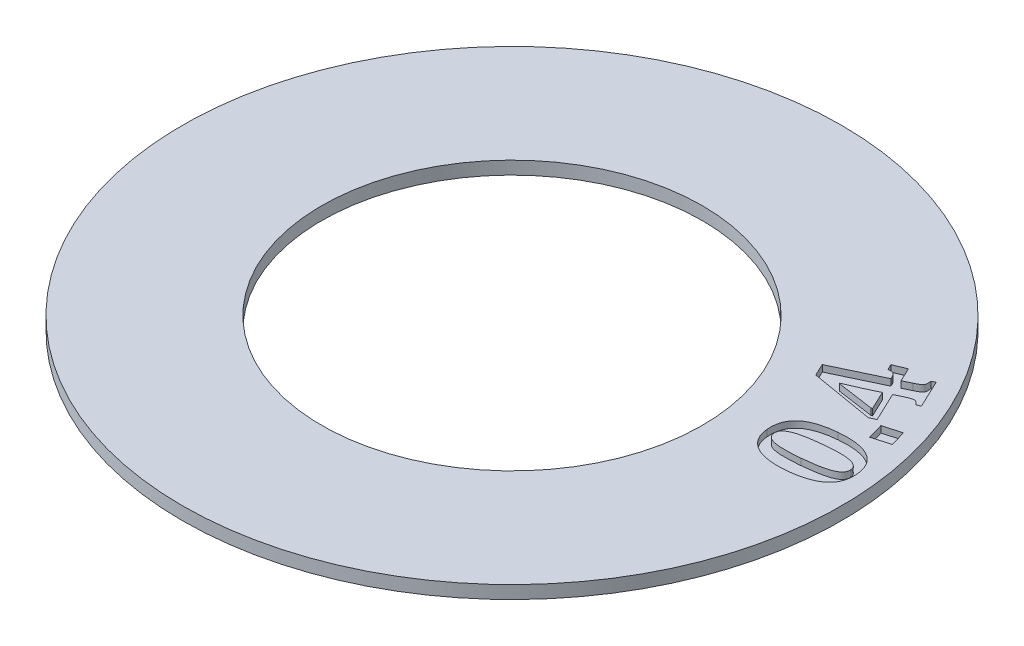
from build123d import *

# Parameters (mm, degrees)
SKETCH1_R           = 10.16
BOSS_EXTRUDE1_DEPTH = 0.4
SKETCH2_R           = 5.8674
CUT_EXTRUDE1_DEPTH  = 15.373976485
CUT_EXTRUDE2_DEPTH  = 0.2


with BuildPart() as part:
    # Sketch1 → Boss-Extrude1 (new body)
    with BuildSketch(Plane(origin=(0, 0, 0), x_dir=(1, 0, 0), z_dir=(0, 1, 0))):
        with Locations(Location((0, 0, 0), (0, 0, 270))):
            Circle(SKETCH1_R)
    extrude(amount=BOSS_EXTRUDE1_DEPTH)

    # Sketch2 → Cut-Extrude1 (cut, through all)
    with BuildSketch(Plane(origin=(0, 0, 0), x_dir=(-1, 0, 0), z_dir=(0, -1, 0))):
        with Locations(Location((0, 0, 0), (0, 0, 90))):
            Circle(SKETCH2_R)
    extrude(amount=-CUT_EXTRUDE1_DEPTH, mode=Mode.SUBTRACT)

    # Sketch4 → Cut-Extrude2 (cut)
    # profile 1 of 3: a face of its own
    with BuildSketch(Plane(origin=(0, 0.4, 0), x_dir=(1, 0, 0), z_dir=(0, 1, 0))):
        with BuildLine():
            add(Edge.make_bspline(
                [(9.548097961, 1.097469618), (9.550055121, 1.073968459), (9.553888422, 1.027939027), (9.554390186, 0.959782463), (9.550385332, 0.894277853), (9.543161692, 0.830950704), (9.529924907, 0.770564877), (9.514466283, 0.712015933), (9.493128413, 0.656576452), (9.46859878, 0.603112304), (9.438240587, 0.552630443), (9.403712845, 0.504076224), (9.363797313, 0.45815636), (9.318530635, 0.414953146), (9.268531255, 0.373440711), (9.212574881, 0.33528609), (9.152201079, 0.298537745), (9.086625336, 0.264527216), (9.015771284, 0.233035098), (8.939390022, 0.204332005), (8.85742296, 0.178713648), (8.770070519, 0.155516755), (8.677361705, 0.135213545), (8.579160422, 0.117686573), (8.475476658, 0.102717037), (8.40435551, 0.095299195), (8.367946051, 0.091501736)],
                knots=[0, 0, 0, 0, 0.959744186, 1.879757445, 2.771360733, 3.630433483, 4.470974874, 5.285729423, 6.092861057, 6.885868194, 7.677321799, 8.486806591, 9.30863703, 10.149710703, 11.031725224, 11.950856355, 12.90393232, 13.90755666, 14.955572763, 16.058595042, 17.227175211, 18.449982035, 19.736657795, 21.08935819, 22.509938377, 24, 24, 24, 24], degree=3))
            add(Edge.make_bspline(
                [(8.367946051, 0.091501736), (8.333424141, 0.088400085), (8.265746233, 0.082319503), (8.165677998, 0.079231171), (8.06952646, 0.077278789), (7.977053794, 0.081155481), (7.88830334, 0.087048161), (7.803306671, 0.098811355), (7.721736112, 0.11170348), (7.644437516, 0.130414375), (7.570830347, 0.151553041), (7.501385565, 0.177166916), (7.435509874, 0.205414386), (7.374430468, 0.238456025), (7.316418733, 0.273272083), (7.263625883, 0.313436527), (7.214343769, 0.356439358), (7.169055169, 0.402772658), (7.128001276, 0.452365342), (7.092229736, 0.505851447), (7.060066365, 0.561822042), (7.033139082, 0.62118597), (7.010403647, 0.683257406), (6.992100676, 0.748449734), (6.979079533, 0.816930644), (6.973464566, 0.863715974), (6.970615322, 0.887456597)],
                knots=[0, 0, 0, 0, 1.373964495, 2.693565985, 3.968553968, 5.185962309, 6.362128109, 7.493465967, 8.586945452, 9.634820339, 10.644545933, 11.621736809, 12.567827687, 13.483617295, 14.373243629, 15.247464012, 16.109610849, 16.964804151, 17.813643683, 18.658252232, 19.51307309, 20.370435758, 21.2393278, 22.1319618, 23.052087694, 24, 24, 24, 24], degree=3))
            add(Edge.make_bspline(
                [(6.970615322, 0.887456597), (6.968008966, 0.924187003), (6.962939891, 0.995623618), (6.968278191, 1.100187869), (6.982752186, 1.198611099), (7.008071475, 1.290725833), (7.04420274, 1.376531671), (7.090804819, 1.455803983), (7.147686668, 1.528817336), (7.215087504, 1.595277348), (7.293061596, 1.655917856), (7.382222508, 1.709460065), (7.481878053, 1.757653835), (7.592113819, 1.79993908), (7.713743669, 1.835405319), (7.845672722, 1.865615588), (7.988759307, 1.889211353), (8.087867057, 1.899976367), (8.139191711, 1.905551215)],
                knots=[0, 0, 0, 0, 0.999181933, 1.943299396, 2.836688392, 3.696188225, 4.530240668, 5.35776012, 6.186181664, 7.036493394, 7.921805995, 8.862264049, 9.85532249, 10.92466266, 12.06451709, 13.293082439, 14.598176172, 16, 16, 16, 16], degree=3))
            add(Edge.make_bspline(
                [(8.139191711, 1.905551215), (8.192076162, 1.909791843), (8.294429148, 1.917999186), (8.443873987, 1.920688736), (8.584142548, 1.915477705), (8.715338175, 1.902057842), (8.837357513, 1.88004073), (8.950319838, 1.850206381), (9.053768445, 1.810845774), (9.148284982, 1.764097891), (9.233267264, 1.708869395), (9.308278218, 1.645097177), (9.373256878, 1.573236551), (9.429154226, 1.493984326), (9.473668524, 1.40587554), (9.508962331, 1.310266213), (9.535431633, 1.206847242), (9.543804449, 1.134545408), (9.548097961, 1.097469618)],
                knots=[0, 0, 0, 0, 1.381791394, 2.674330027, 3.891007168, 5.036428095, 6.106690612, 7.117972597, 8.075364145, 8.985087285, 9.859944246, 10.708764313, 11.542333244, 12.37753583, 13.227367402, 14.105765436, 15.028652003, 16, 16, 16, 16], degree=3))
        make_face()
        with BuildLine():
            add(Edge.make_bspline(
                [(8.261561502, 0.646575521), (8.294456414, 0.649821856), (8.358447364, 0.656137), (8.451849855, 0.666375212), (8.539943244, 0.678399643), (8.622970291, 0.689310262), (8.700369127, 0.702561563), (8.772745842, 0.714744092), (8.839767332, 0.728682456), (8.901986015, 0.742841894), (8.959241455, 0.758465051), (9.012361258, 0.774117371), (9.061070952, 0.791611955), (9.106204362, 0.808792317), (9.147102593, 0.82752915), (9.183769707, 0.847406728), (9.216251369, 0.868414663), (9.253841893, 0.896112176), (9.292161978, 0.93470985), (9.324279971, 0.987899004), (9.341430959, 1.046837895), (9.339946559, 1.087265986), (9.33918737, 1.107942708)],
                knots=[0, 0, 0, 0, 1.559939649, 3.034573339, 4.433834629, 5.755759396, 6.985974602, 8.139252337, 9.219098498, 10.216076828, 11.149973839, 12.019543174, 12.828554085, 13.591800542, 14.297942877, 14.949827997, 15.558345547, 16.121961591, 17.152098737, 18.100852136, 19.028691373, 20, 20, 20, 20], degree=3))
            add(Edge.make_bspline(
                [(9.33918737, 1.107942708), (9.337640701, 1.119206946), (9.334605741, 1.141310259), (9.325241811, 1.172734036), (9.31176771, 1.201590004), (9.293873227, 1.227812058), (9.271323703, 1.251644445), (9.244711652, 1.274008937), (9.212873286, 1.293547355), (9.176637524, 1.311985124), (9.135144771, 1.328439431), (9.087936038, 1.342704924), (9.03486756, 1.354683111), (8.975778101, 1.364445967), (8.910136784, 1.372235916), (8.83765802, 1.377138278), (8.757841853, 1.378355959), (8.671282468, 1.377765829), (8.578631856, 1.375199821), (8.480728235, 1.369181036), (8.377787239, 1.362348998), (8.307484328, 1.355956026), (8.271483377, 1.352682292)],
                knots=[0, 0, 0, 0, 0.573306212, 1.12497326, 1.647738541, 2.175091007, 2.719775143, 3.2992746, 3.924540973, 4.60063781, 5.349821626, 6.17422386, 7.087672211, 8.09400518, 9.19609116, 10.423188986, 11.759030231, 13.224456304, 14.792560164, 16.436793354, 18.175341204, 20, 20, 20, 20], degree=3))
            add(Edge.make_bspline(
                [(8.271483377, 1.352682292), (8.21872765, 1.347383023), (8.117512767, 1.337216074), (7.972444719, 1.319230054), (7.840842152, 1.298928139), (7.722599788, 1.277041996), (7.617710788, 1.253595709), (7.525847566, 1.228398034), (7.447076026, 1.201897522), (7.380933906, 1.17356744), (7.325919961, 1.144098193), (7.28035653, 1.113538037), (7.243905652, 1.081205208), (7.215355923, 1.047943532), (7.195791651, 1.012267519), (7.182777989, 0.975237705), (7.176443594, 0.935977323), (7.177754028, 0.909335291), (7.178423481, 0.895724826)],
                knots=[0, 0, 0, 0, 1.987774042, 3.813658246, 5.479624312, 6.979295976, 8.321212524, 9.507797241, 10.549079436, 11.434594746, 12.202068828, 12.886080949, 13.486172645, 14.024182533, 14.520633445, 15.002090577, 15.490203663, 16, 16, 16, 16], degree=3))
            add(Edge.make_bspline(
                [(7.178423481, 0.895724826), (7.18057015, 0.880150586), (7.184763265, 0.849729237), (7.201322999, 0.807002831), (7.225450517, 0.768795664), (7.257660898, 0.735091078), (7.298058684, 0.706441494), (7.346173767, 0.682368855), (7.401776004, 0.661890172), (7.465624388, 0.646320653), (7.537344011, 0.634570729), (7.61681871, 0.625748345), (7.704218452, 0.620988642), (7.799654696, 0.620157169), (7.90331396, 0.622569433), (8.015409368, 0.627671035), (8.13581459, 0.635163946), (8.218766894, 0.642691896), (8.261561502, 0.646575521)],
                knots=[0, 0, 0, 0, 0.622531695, 1.215998619, 1.802972471, 2.4067536, 3.054715399, 3.759494987, 4.537400922, 5.402670149, 6.364594255, 7.421637757, 8.576224243, 9.838461732, 11.210360544, 12.692839009, 14.293854979, 16, 16, 16, 16], degree=3))
        make_face(mode=Mode.SUBTRACT)
    # profile 2 of 3: a face of its own
    with BuildSketch(Plane(origin=(0, 0.4, 0), x_dir=(1, 0, 0), z_dir=(0, 1, 0))):
        Polygon((8.625595186, 2.745808752), (9.166888588, 2.901802676), (9.305794838, 2.420040523), (8.764501436, 2.264046599), align=None)
    # profile 3 of 3: a face of its own
    with BuildSketch(Plane(origin=(0, 0.4, 0), x_dir=(1, 0, 0), z_dir=(0, 1, 0))):
        with BuildLine():
            add(Edge.make_bspline(
                [(8.619317249, 3.839927612), (8.605158045, 3.855725986), (8.579584678, 3.884259905), (8.53958882, 3.918625978), (8.500604376, 3.943003738), (8.45722757, 3.951692461), (8.409998964, 3.948170804), (8.357468269, 3.932017987), (8.295899496, 3.907532011), (8.252095124, 3.887046328), (8.227954402, 3.875756605)],
                knots=[0, 0, 0, 0, 1.145744956, 2.069364517, 2.848247227, 3.600500716, 4.416765074, 5.385816981, 6.559315799, 8, 8, 8, 8], degree=3))
            Line((8.227954402, 3.875756605), (7.97604902, 3.75614289))
            Line((7.97604902, 3.75614289), (8.405996937, 2.851047404))
            Line((8.405996937, 2.851047404), (8.22354468, 2.764506605))
            Line((8.22354468, 2.764506605), (6.271691381, 3.093582126))
            Line((6.271691381, 3.093582126), (6.091443986, 3.473369452))
            Line((6.091443986, 3.473369452), (7.526257354, 4.154671536))
            Line((7.526257354, 4.154671536), (7.501452666, 4.207036987))
            add(Edge.make_bspline(
                [(7.501452666, 4.207036987), (7.495284595, 4.219752104), (7.483913694, 4.24319255), (7.467211949, 4.274824047), (7.45117189, 4.299250025), (7.432395351, 4.323142031), (7.404957274, 4.344998672), (7.371590737, 4.356451311), (7.340311976, 4.361880797), (7.310475748, 4.360944463), (7.275108034, 4.358439211), (7.249890175, 4.354257285), (7.236318118, 4.352006605)],
                knots=[0, 0, 0, 0, 1.244291285, 2.293863494, 3.146294454, 3.81324823, 4.96527056, 6.173175222, 6.877899736, 7.751404011, 8.789822906, 10, 10, 10, 10], degree=3))
            Line((7.236318118, 4.352006605), (7.15198218, 4.529497925))
            Line((7.15198218, 4.529497925), (7.534525583, 4.686043063))
            Line((7.534525583, 4.686043063), (7.739026451, 4.255543931))
            Line((7.739026451, 4.255543931), (7.990931833, 4.375157647))
            add(Edge.make_bspline(
                [(7.990931833, 4.375157647), (8.004889816, 4.382148034), (8.031410843, 4.395430199), (8.069069943, 4.414115601), (8.100867186, 4.433198132), (8.135895536, 4.454798796), (8.170657619, 4.48180517), (8.200545356, 4.517905625), (8.218913798, 4.556617267), (8.221958568, 4.600329456), (8.217615413, 4.648907387), (8.212529795, 4.683673908), (8.209764298, 4.702579522)],
                knots=[0, 0, 0, 0, 1.05478597, 2.004158271, 2.838732487, 3.558503911, 4.785687942, 5.791874313, 6.703150114, 7.627104706, 8.709648202, 10, 10, 10, 10], degree=3))
            Line((8.209764298, 4.702579522), (8.321109784, 4.755496188))
            Line((8.321109784, 4.755496188), (8.730662736, 3.892844279))
            Line((8.730662736, 3.892844279), (8.619317249, 3.839927612))
        make_face()
        with BuildLine():
            Line((8.037785131, 3.077596883), (7.763279923, 3.655270494))
            Line((7.763279923, 3.655270494), (7.376878013, 3.471715806))
            add(Edge.make_bspline(
                [(7.376878013, 3.471715806), (7.293366138, 3.433055727), (7.122021893, 3.353735487), (6.947231905, 3.282323746), (6.857633222, 3.245717543)],
                knots=[0, 0, 0, 0, 0.974784713, 2, 2, 2, 2], degree=3))
            Line((6.857633222, 3.245717543), (6.865350236, 3.229181084))
            Line((6.865350236, 3.229181084), (8.009121937, 3.063816501))
            Line((8.009121937, 3.063816501), (8.037785131, 3.077596883))
        make_face(mode=Mode.SUBTRACT)
    extrude(amount=-CUT_EXTRUDE2_DEPTH, mode=Mode.SUBTRACT)


solid = part.part
